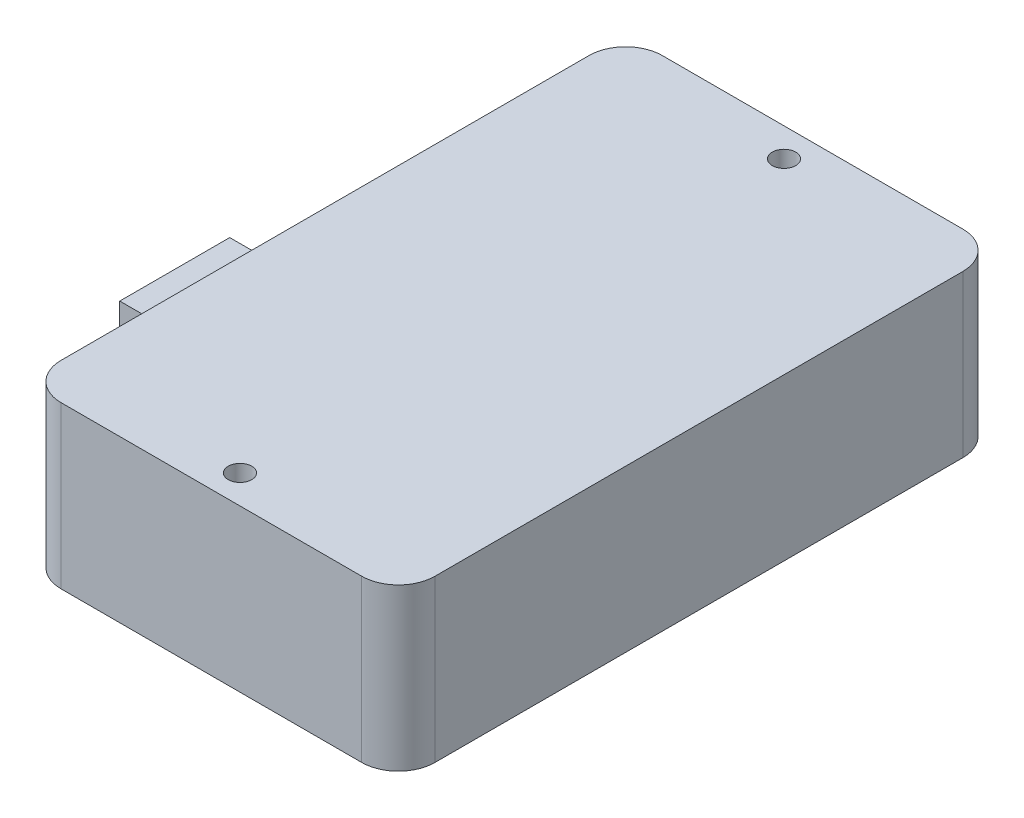
from build123d import *

# Parameters (mm, degrees)
SKETCH1_R           = 1.6
BOSS_EXTRUDE1_DEPTH = 22
SKETCH1_3_W         = 10
SKETCH1_3_H         = 15
BOSS_EXTRUDE2_DEPTH = 15
FILLET1_R           = 5


with BuildPart() as part:
    # Sketch1 → Boss-Extrude1 (new body)
    with BuildSketch(Plane(origin=(0, 0, 0), x_dir=(1, 0, 0), z_dir=(0, 1, 0))):
        Polygon((-25.5, -18), (-25.5, -41), (25.5, -41), (25.5, -25.5), (25.5, -17), (25.5, 41), (-25.5, 41), (-25.5, -3), align=None)
        with Locations((0, -37.1)):
            Circle(SKETCH1_R, mode=Mode.SUBTRACT)
        with Locations((0, 37.1)):
            Circle(SKETCH1_R, mode=Mode.SUBTRACT)
    extrude(amount=BOSS_EXTRUDE1_DEPTH)

    # Sketch1<3> → Boss-Extrude2 (add)
    with BuildSketch(Plane(origin=(0, 0, 0), x_dir=(1, 0, 0), z_dir=(0, 1, 0))):
        with Locations((-30.5, -10.5)):
            Rectangle(SKETCH1_3_W, SKETCH1_3_H)
    extrude(amount=BOSS_EXTRUDE2_DEPTH)

    # Fillet1
    fillet1_edges = [part.edges().sort_by_distance(p)[0] for p in [
        (-25.5, 11, -41),
        (25.5, 11, -41),
        (25.5, 11, 41),
        (-25.5, 11, 41),
    ]]
    fillet(fillet1_edges, radius=FILLET1_R)


solid = part.part
